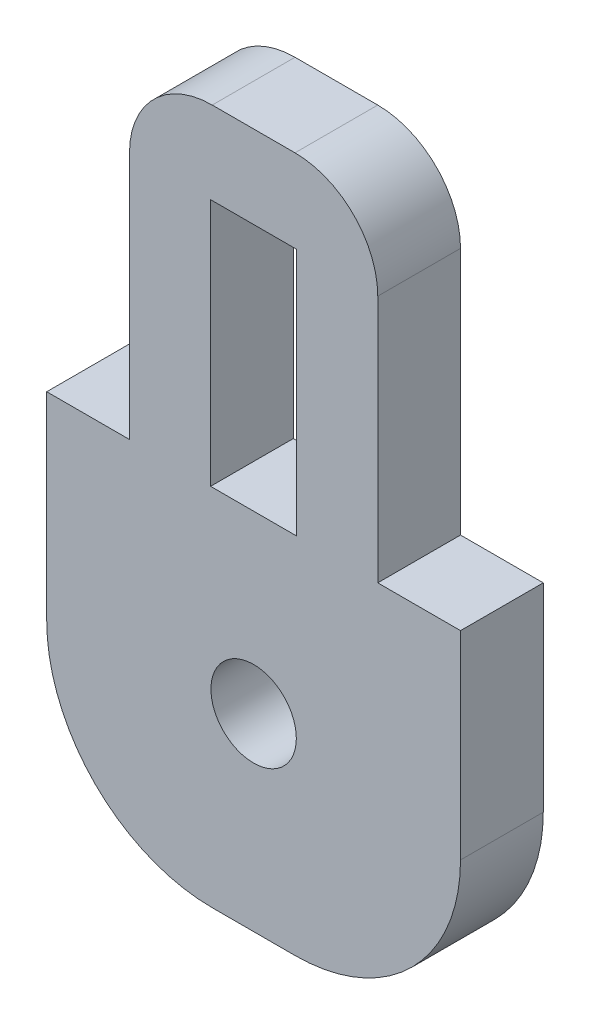
from build123d import *

# Parameters (mm, degrees)
SKETCH1_R           = 1.6383
SKETCH1_W           = 3.302
SKETCH1_H           = 9.525
BOSS_EXTRUDE1_DEPTH = 3.175


with BuildPart() as part:
    # Sketch1 → Boss-Extrude1 (new body)
    with BuildSketch(Plane.XY):
        with BuildLine():
            Line((-1.5875, 19.685), (1.5875, 19.685))
            ThreePointArc((1.5875, 19.685), (3.83256403, 18.75506403), (4.7625, 16.51))
            Line((4.7625, 16.51), (4.7625, 6.985))
            Line((4.7625, 6.985), (7.9375, 6.985))
            Line((7.9375, 6.985), (7.9375, -0.635))
            ThreePointArc((7.9375, -0.635), (6.077628061, -5.125128061), (1.5875, -6.985))
            Line((1.5875, -6.985), (-1.5875, -6.985))
            ThreePointArc((-1.5875, -6.985), (-6.077628061, -5.125128061), (-7.9375, -0.635))
            Line((-7.9375, -0.635), (-7.9375, 6.985))
            Line((-7.9375, 6.985), (-4.7625, 6.985))
            Line((-4.7625, 6.985), (-4.7625, 16.51))
            ThreePointArc((-4.7625, 16.51), (-3.83256403, 18.75506403), (-1.5875, 19.685))
        make_face()
        with Locations((0, 0.254)):
            Circle(SKETCH1_R, mode=Mode.SUBTRACT)
        with Locations((0, 11.7475)):
            Rectangle(SKETCH1_W, SKETCH1_H, mode=Mode.SUBTRACT)
    extrude(amount=BOSS_EXTRUDE1_DEPTH)


solid = part.part
